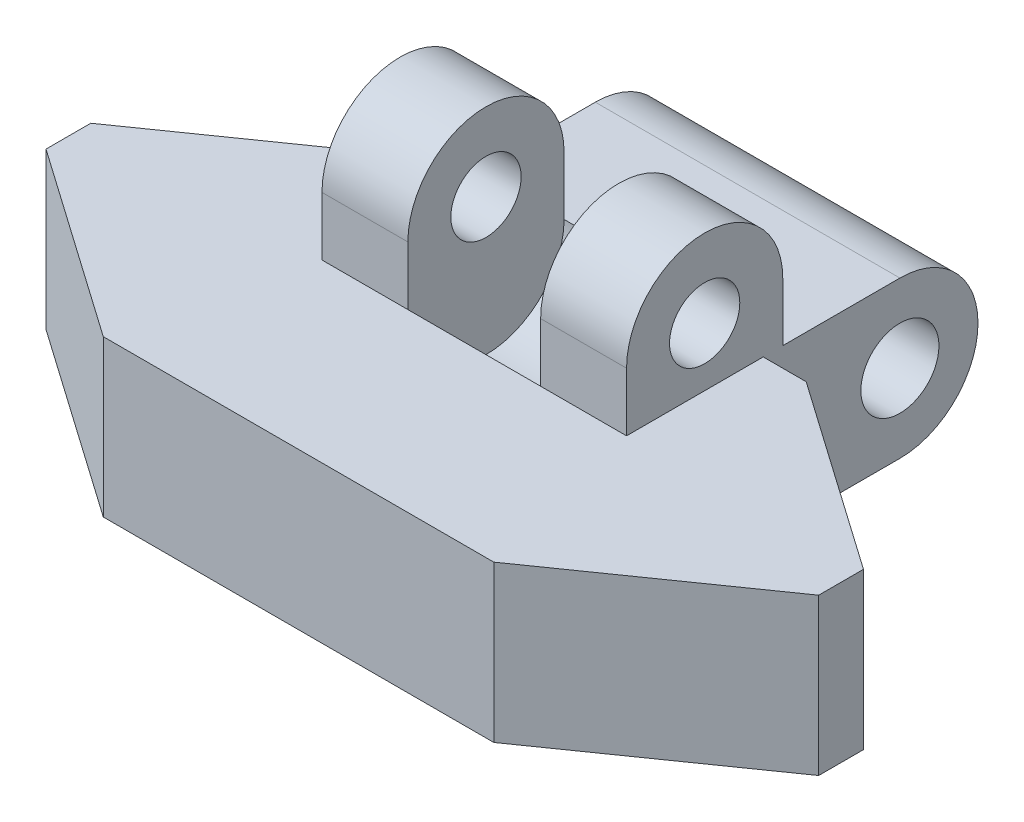
from build123d import *

# Parameters (mm, degrees)
BOSS_EXTRUDE1_DEPTH      = 4
BOSS_EXTRUDE2_DEPTH      = 3.9
BOSS_EXTRUDE2_DEPTH_BACK = 3.9
SKETCH2_R                = 1
BOSS_EXTRUDE3_DEPTH      = 3.9
BOSS_EXTRUDE3_DEPTH_BACK = 3.9
SKETCH4_R                = 0.9
CUT_EXTRUDE1_REACH       = 20.341
SKETCH5_W                = 3.4
SKETCH5_H                = 3.5
CUT_EXTRUDE2_DEPTH       = 3.4


with BuildPart() as part:
    # Sketch1 → Boss-Extrude1 (new body)
    with BuildSketch(Plane(origin=(0, 0, 0), x_dir=(1, 0, 0), z_dir=(0, 1, 0))):
        Polygon((-5, 4), (5, 4), (9.893439983, 0.573576436), (9.893439983, -0.573576436), (5, -4), (-5, -4), (-9.893439983, -0.573576436), (-9.893439983, 0.573576436), align=None)
    extrude(amount=BOSS_EXTRUDE1_DEPTH)

    # Sketch2 → Boss-Extrude2 (add, two sides: drawn at the far end of the back side and taken through both)
    with BuildSketch(Plane(origin=(0, 0, 0), x_dir=(0, 0, -1), z_dir=(1, 0, 0)).offset(-BOSS_EXTRUDE2_DEPTH_BACK)):
        with BuildLine():
            Line((4, 4), (7.5, 4))
            ThreePointArc((7.5, 4), (9.5, 2), (7.5, 0))
            Line((7.5, 0), (4, 0))
            Line((4, 0), (4, 4))
        make_face()
        with Locations((7.5, 2)):
            Circle(SKETCH2_R, mode=Mode.SUBTRACT)
    extrude(amount=BOSS_EXTRUDE2_DEPTH + BOSS_EXTRUDE2_DEPTH_BACK)

    # Sketch4 → Boss-Extrude3 (add, two sides: drawn at the far end of the back side and taken through both)
    with BuildSketch(Plane(origin=(0, 0, 0), x_dir=(0, 0, -1), z_dir=(1, 0, 0)).offset(-BOSS_EXTRUDE3_DEPTH_BACK)):
        with BuildLine():
            Line((0.5, 4), (4.5, 4))
            Line((4.5, 4), (4.5, 5.5))
            ThreePointArc((4.5, 5.5), (2.5, 7.5), (0.5, 5.5))
            Line((0.5, 5.5), (0.5, 4))
        make_face()
        with Locations((2.5, 5.5)):
            Circle(SKETCH4_R, mode=Mode.SUBTRACT)
    extrude(amount=BOSS_EXTRUDE3_DEPTH + BOSS_EXTRUDE3_DEPTH_BACK)

    # Sketch5 → Cut-Extrude1 (cut, up to next)
    with BuildSketch(Plane.XY.offset(4), mode=Mode.PRIVATE) as cut_extrude1_sk1:
        with Locations((0, 5.75)):
            Rectangle(SKETCH5_W, SKETCH5_H)
    cut_extrude1_tool1 = extrude(cut_extrude1_sk1.sketch, amount=-CUT_EXTRUDE1_REACH, mode=Mode.PRIVATE) & part.part
    add(cut_extrude1_tool1.solids().sort_by_distance((0, 5.75, 4))[0], mode=Mode.SUBTRACT)

    # Sketch6 → Cut-Extrude2 (cut)
    with BuildSketch(Plane.ZY.offset(-1.7)):
        with BuildLine():
            Line((-4.5, 4), (-0.5, 4))
            ThreePointArc((-0.5, 4), (-2.5, 2), (-4.5, 4))
        make_face()
    extrude(amount=CUT_EXTRUDE2_DEPTH, mode=Mode.SUBTRACT)


solid = part.part
